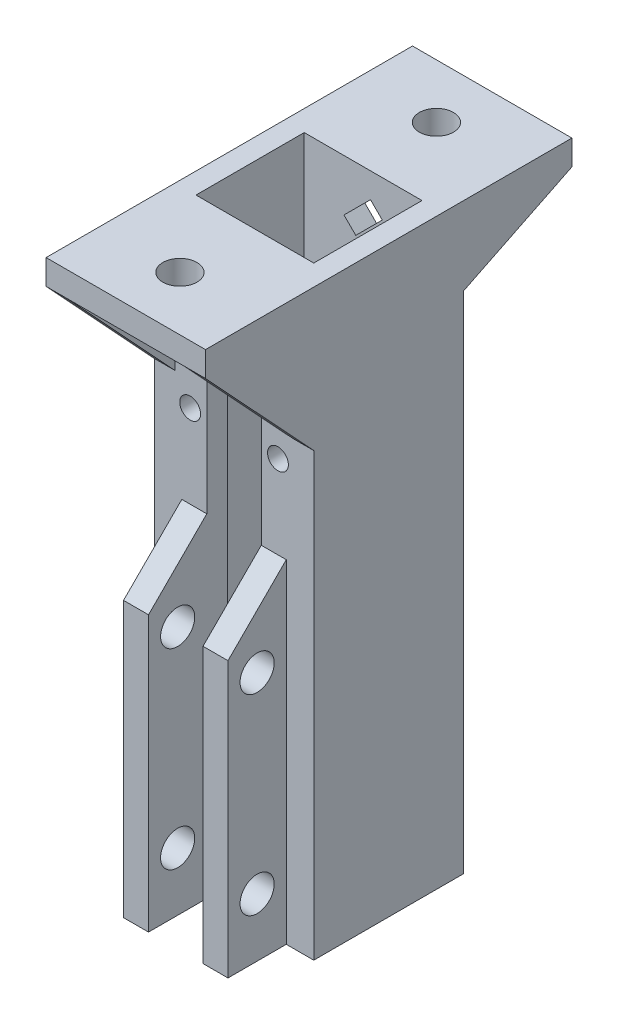
from build123d import *

# Parameters (mm, degrees)
SKETCH2_W                = 2.5
SKETCH2_H                = 2.5
SKETCH2_W_2              = 14.143059905
SKETCH2_H_2              = 13
SKETCH2_W_3              = 3
SKETCH2_H_3              = 7
BOSS_EXTRUDE1_DEPTH      = 40
SKETCH3_R                = 2.05
CUT_EXTRUDE2_DEPTH       = 40
BOSS_EXTRUDE11_DEPTH     = 30
SKETCH16_R               = 1.25
CUT_EXTRUDE9_DEPTH       = 3.5
SKETCH17_R               = 1.25
CUT_EXTRUDE10_DEPTH      = 3.5
SKETCH18_W               = 19.143059905
SKETCH18_H               = 3
BOSS_EXTRUDE4_DEPTH      = 15.5
BOSS_EXTRUDE5_DEPTH      = 13
BOSS_EXTRUDE5_DEPTH_BACK = 2
SKETCH19_W               = 19.143059905
SKETCH19_H               = 3
BOSS_EXTRUDE6_DEPTH      = 2.5
BOSS_EXTRUDE8_DEPTH      = 2.5
BOSS_EXTRUDE9_DEPTH      = 2.5
BOSS_EXTRUDE10_DEPTH     = 2.5
SKETCH25_R               = 2.05
CUT_EXTRUDE12_DEPTH      = 3.5
SKETCH27_W               = 6.543059905
SKETCH27_H               = 2.5
BOSS_EXTRUDE12_DEPTH     = 12
FILLET1_R                = 1
CUT_EXTRUDE13_DEPTH      = 78.840525416
CUT_EXTRUDE14_DEPTH      = 78.280272448


with BuildPart() as part:
    # Sketch2 → Boss-Extrude1 (new body)
    with BuildSketch(Plane(origin=(0, 0, 0), x_dir=(1, 0, 0), z_dir=(0, 1, 0))):
        with Locations((-12.826483829, 1.092750264)):
            Rectangle(SKETCH2_W, SKETCH2_H)
        with Locations((-4.504953877, 1.092750264)):
            Rectangle(SKETCH2_W_2, SKETCH2_H)
        with Locations((-12.826483829, -6.657249736)):
            Rectangle(SKETCH2_W, SKETCH2_H_2)
        with Locations((3.816576076, 1.092750264)):
            Rectangle(SKETCH2_W, SKETCH2_H)
        Polygon((-11.576483829, -13.157249736), (-14.076483829, -13.157249736), (-14.076483829, -15.657249736), (-10.776483829, -15.657249736), (-7.776483829, -15.657249736), (-7.776483829, -13.157249736), align=None)
        with Locations((3.816576076, -6.657249736)):
            Rectangle(SKETCH2_W, SKETCH2_H_2)
        Polygon((5.066576076, -13.157249736), (2.566576076, -13.157249736), (-1.233423924, -13.157249736), (-1.233423924, -15.657249736), (1.766576076, -15.657249736), (5.066576076, -15.657249736), align=None)
        with Locations((-9.276483829, -19.157249736)):
            Rectangle(SKETCH2_W_3, SKETCH2_H_3)
        with Locations((0.266576076, -19.157249736)):
            Rectangle(SKETCH2_W_3, SKETCH2_H_3)
    extrude(amount=BOSS_EXTRUDE1_DEPTH)

    # Sketch3 → Cut-Extrude2 (cut)
    with BuildSketch(Plane.ZY.offset(10.776483829)):
        with Locations((19.157249736, 30)):
            Circle(SKETCH3_R)
        with Locations((19.157249736, 7)):
            Circle(SKETCH3_R)
    extrude(amount=-CUT_EXTRUDE2_DEPTH, mode=Mode.SUBTRACT)

    # Sketch26 → Boss-Extrude11 (add)
    with BuildSketch(Plane(origin=(0, 40, 0), x_dir=(1, 0, 0), z_dir=(0, 1, 0))):
        Polygon((-1.233423924, -15.657249736), (1.766576076, -15.657249736), (5.066576076, -15.657249736), (5.066576076, 2.342750264), (-14.076483829, 2.342750264), (-14.076483829, -15.657249736), (-7.776483829, -15.657249736), (-7.776483829, -13.157249736), (-11.576483829, -13.157249736), (-11.576483829, -0.157249736), (2.566576076, -0.157249736), (2.566576076, -13.157249736), (-1.233423924, -13.157249736), align=None)
    extrude(amount=BOSS_EXTRUDE11_DEPTH)

    # Sketch16 → Cut-Extrude9 (cut)
    with BuildSketch(Plane.XY.offset(15.657249736)):
        with Locations((-9.776483829, 50)):
            Circle(SKETCH16_R)
    extrude(amount=-CUT_EXTRUDE9_DEPTH, mode=Mode.SUBTRACT)

    # Sketch17 → Cut-Extrude10 (cut)
    with BuildSketch(Plane.XY.offset(15.657249736)):
        with Locations((0.766576076, 50)):
            Circle(SKETCH17_R)
    extrude(amount=-CUT_EXTRUDE10_DEPTH, mode=Mode.SUBTRACT)

    # Sketch18 → Boss-Extrude4 (add)
    with BuildSketch(Plane(origin=(0, 0, 13.157249736), x_dir=(-1, 0, 0), z_dir=(0, 0, -1))):
        with Locations((4.504953877, 68.5)):
            Rectangle(SKETCH18_W, SKETCH18_H)
    extrude(amount=-BOSS_EXTRUDE4_DEPTH)

    # Sketch19 → Boss-Extrude5 (add, two sides: drawn at the far end of the back side and taken through both)
    with BuildSketch(Plane(origin=(0, 0, -2.342750264), x_dir=(-1, 0, 0), z_dir=(0, 0, -1)).offset(-BOSS_EXTRUDE5_DEPTH_BACK)):
        with Locations((4.504953877, 68.5)):
            Rectangle(SKETCH19_W, SKETCH19_H)
    extrude(amount=BOSS_EXTRUDE5_DEPTH + BOSS_EXTRUDE5_DEPTH_BACK)

    # Sketch21 → Boss-Extrude6 (add)
    with BuildSketch(Plane.ZY.offset(14.076483829)):
        Polygon((28.657249736, 67), (15.657249736, 53), (15.657249736, 67), align=None)
    extrude(amount=-BOSS_EXTRUDE6_DEPTH)

    # Sketch22 → Boss-Extrude8 (add)
    with BuildSketch(Plane(origin=(5.066576076, 0, 0), x_dir=(0, 0, -1), z_dir=(1, 0, 0))):
        Polygon((-28.657249736, 67), (-15.657249736, 67), (-15.657249736, 53), align=None)
    extrude(amount=-BOSS_EXTRUDE8_DEPTH)

    # Sketch23 → Boss-Extrude9 (add)
    with BuildSketch(Plane(origin=(5.066576076, 0, 0), x_dir=(0, 0, -1), z_dir=(1, 0, 0))):
        Polygon((-13.157249736, 70), (-13.157249736, 53), (15.342750264, 67), (15.342750264, 70), align=None)
    extrude(amount=-BOSS_EXTRUDE9_DEPTH)

    # Sketch24 → Boss-Extrude10 (add)
    with BuildSketch(Plane.ZY.offset(14.076483829)):
        Polygon((13.157249736, 70), (-15.342750264, 70), (-15.342750264, 67), (13.157249736, 53), align=None)
    extrude(amount=-BOSS_EXTRUDE10_DEPTH)

    # Sketch25 → Cut-Extrude12 (cut)
    with BuildSketch(Plane(origin=(0, 70, 0), x_dir=(1, 0, 0), z_dir=(0, 1, 0))):
        with Locations(Location((-4.704953829, 8.842750264, 0), (0, 0, 270))):
            Circle(SKETCH25_R)
        with Locations(Location((-4.504953767, -22.157249736, 0), (0, 0, 270))):
            Circle(SKETCH25_R)
    extrude(amount=-CUT_EXTRUDE12_DEPTH, mode=Mode.SUBTRACT)

    # Sketch27 → Boss-Extrude12 (add)
    with BuildSketch(Plane.XZ.offset(-67)):
        with Locations((-4.504953877, 14.407249736)):
            Rectangle(SKETCH27_W, SKETCH27_H)
    extrude(amount=BOSS_EXTRUDE12_DEPTH)

    # Fillet1
    fillet1_edges = [part.edges().sort_by_distance(p)[0] for p in [
        (-1.233423924, 55, 14.407249736),
        (-7.776483829, 55, 14.407249736),
    ]]
    fillet(fillet1_edges, radius=FILLET1_R)

    # Sketch28 → Cut-Extrude13 (cut, through all)
    with BuildSketch(Plane.XY.offset(15.657249736)):
        Polygon((-3.621040447, 66.996521667), (-6.803020962, 63.814541152), (-5.3888074, 62.40032759), (-2.206826885, 65.582308105), align=None)
        Polygon((-3.621040447, 63.496521667), (-6.803020962, 60.314541152), (-5.3888074, 58.90032759), (-2.206826885, 62.082308105), align=None)
        Polygon((-3.621040447, 59.996521667), (-6.803020962, 56.814541152), (-5.3888074, 55.40032759), (-2.206826885, 58.582308105), align=None)
    extrude(amount=-CUT_EXTRUDE13_DEPTH, mode=Mode.SUBTRACT)

    # Sketch29 → Cut-Extrude14 (cut, through all)
    with BuildSketch(Plane(origin=(1.766576076, 0, 0), x_dir=(0, 0, -1), z_dir=(1, 0, 0))):
        Polygon((-15.657249736, 40), (-22.657249736, 40), (-22.657249736, 33), align=None)
    extrude(amount=-CUT_EXTRUDE14_DEPTH, mode=Mode.SUBTRACT)


solid = part.part
